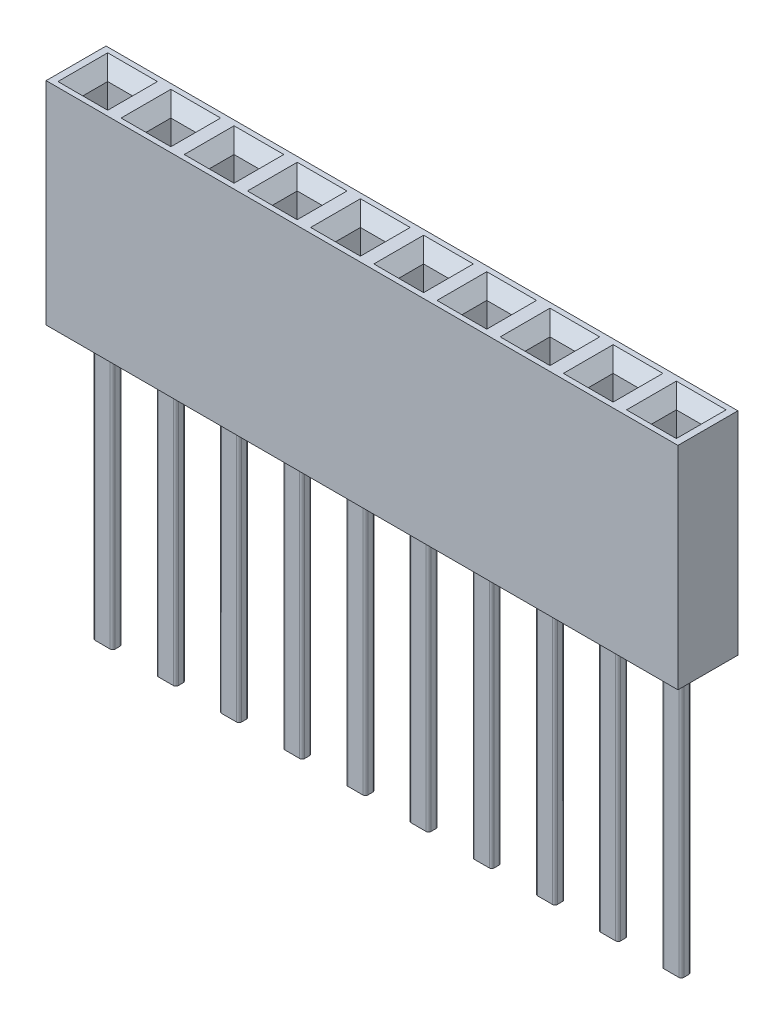
from build123d import *

# Parameters (mm, degrees)
SKETCH2_W                  = 25.4
SKETCH2_H                  = 2.41
BOSS_EXTRUDE1_DEPTH        = 8.51
SKETCH5_W                  = 1
SKETCH5_H                  = 1
CUT_EXTRUDE1_DEPTH         = 5
CHAMFER1_SIZE              = 0.5
LPATTERN3_COUNT            = 10
LPATTERN3_PITCH            = 2.54
CHAMFER1_OF_LPATTERN3_SIZE = 0.5
BOSS_EXTRUDE2_DEPTH        = 11
LPATTERN1_COUNT            = 10
LPATTERN1_PITCH            = 2.54


with BuildPart() as part:
    # Sketch2 → Boss-Extrude1 (new body)
    with BuildSketch(Plane(origin=(0, 0, 0), x_dir=(1, 0, 0), z_dir=(0, 1, 0))):
        with Locations((11.43, 0)):
            Rectangle(SKETCH2_W, SKETCH2_H)
    extrude(amount=BOSS_EXTRUDE1_DEPTH)

    # Sketch5 → Cut-Extrude1 (cut)
    with BuildSketch(Plane(origin=(0, 8.51, 0), x_dir=(1, 0, 0), z_dir=(0, 1, 0))):
        Rectangle(SKETCH5_W, SKETCH5_H)
    cut_extrude1 = extrude(amount=-CUT_EXTRUDE1_DEPTH, mode=Mode.SUBTRACT)

    # Chamfer1
    chamfer1_edges = [part.edges().sort_by_distance(p)[0] for p in [
        (-0.5, 8.51, 0),
        (0, 8.51, 0.5),
        (0.5, 8.51, 0),
        (0, 8.51, -0.5),
    ]]
    chamfer(chamfer1_edges, length=CHAMFER1_SIZE)

    # LPattern3: Cut-Extrude1 ×10
    with Locations(*[(i * LPATTERN3_PITCH, 0, 0) for i in range(1, LPATTERN3_COUNT)]):
        add(cut_extrude1, mode=Mode.SUBTRACT)

    # Chamfer1 of LPattern3
    chamfer1_of_lpattern3_edges = [part.edges().sort_by_distance(p)[0] for p in [
        (2.04, 8.51, 0),
        (2.54, 8.51, 0.5),
        (3.04, 8.51, 0),
        (2.54, 8.51, -0.5),
        (4.58, 8.51, 0),
        (5.08, 8.51, 0.5),
        (5.58, 8.51, 0),
        (5.08, 8.51, -0.5),
        (7.12, 8.51, 0),
        (7.62, 8.51, 0.5),
        (8.12, 8.51, 0),
        (7.62, 8.51, -0.5),
        (9.66, 8.51, 0),
        (10.16, 8.51, 0.5),
        (10.66, 8.51, 0),
        (10.16, 8.51, -0.5),
        (12.2, 8.51, 0),
        (12.7, 8.51, 0.5),
        (13.2, 8.51, 0),
        (12.7, 8.51, -0.5),
        (14.74, 8.51, 0),
        (15.24, 8.51, 0.5),
        (15.74, 8.51, 0),
        (15.24, 8.51, -0.5),
        (17.28, 8.51, 0),
        (17.78, 8.51, 0.5),
        (18.28, 8.51, 0),
        (17.78, 8.51, -0.5),
        (19.82, 8.51, 0),
        (20.32, 8.51, 0.5),
        (20.82, 8.51, 0),
        (20.32, 8.51, -0.5),
        (22.36, 8.51, 0),
        (22.86, 8.51, 0.5),
        (23.36, 8.51, 0),
        (22.86, 8.51, -0.5),
    ]]
    chamfer(chamfer1_of_lpattern3_edges, length=CHAMFER1_OF_LPATTERN3_SIZE)

    # Sketch8 → Boss-Extrude2 (add)
    with BuildSketch(Plane(origin=(0, 0, 0), x_dir=(1, 0, 0), z_dir=(0, 1, 0))):
        with BuildLine():
            Line((-0.3, -0.2), (0.3, -0.2))
            ThreePointArc((0.3, -0.2), (0.370710678, -0.170710678), (0.4, -0.1))
            Line((0.4, -0.1), (0.4, 0.1))
            ThreePointArc((0.4, 0.1), (0.370710678, 0.170710678), (0.3, 0.2))
            Line((0.3, 0.2), (-0.3, 0.2))
            ThreePointArc((-0.3, 0.2), (-0.370710678, 0.170710678), (-0.4, 0.1))
            Line((-0.4, 0.1), (-0.4, -0.1))
            ThreePointArc((-0.4, -0.1), (-0.370710678, -0.170710678), (-0.3, -0.2))
        make_face()
    boss_extrude2 = extrude(amount=-BOSS_EXTRUDE2_DEPTH)

    # LPattern1: Boss-Extrude2 ×10
    with Locations(*[(i * LPATTERN1_PITCH, 0, 0) for i in range(1, LPATTERN1_COUNT)]):
        add(boss_extrude2)


solid = part.part
